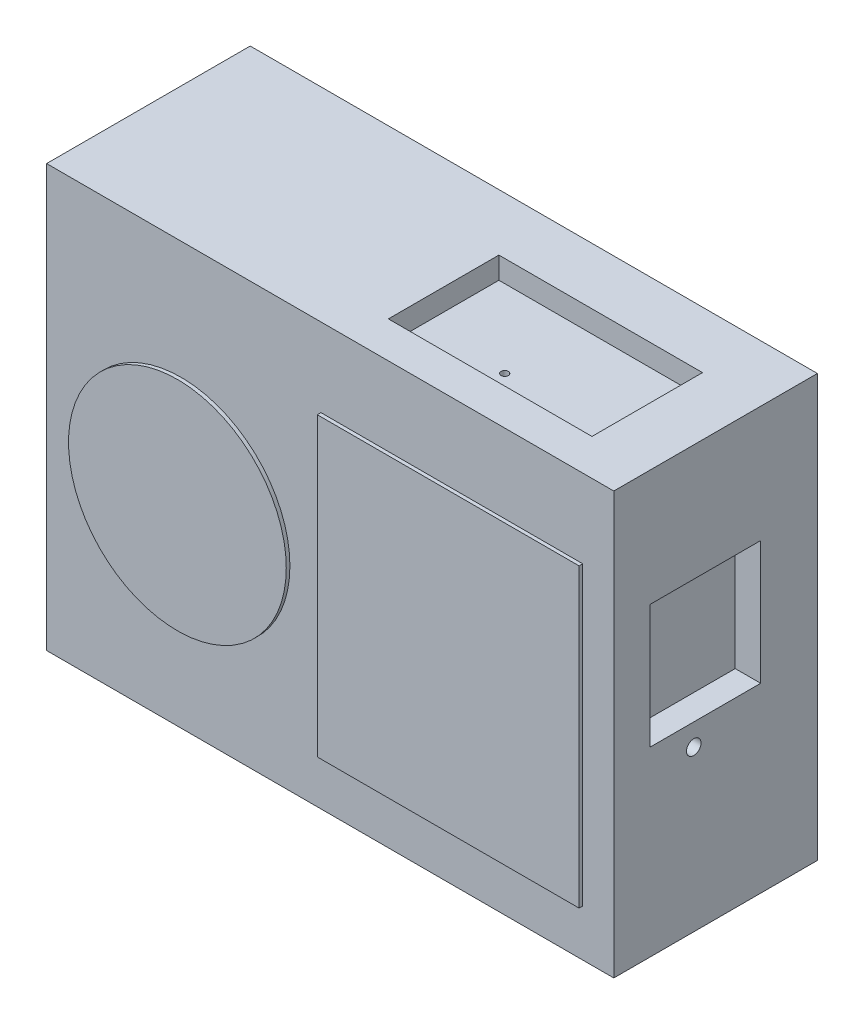
from build123d import *

# Parameters (mm, degrees)
SKETCH_1_W          = 78
SKETCH_1_H          = 58
EXTRUDE_1_DEPTH     = 28
SKETCH_2_W          = 28
SKETCH_2_H          = 15.2
CUT_EXTRUDE_1_DEPTH = 3
SKETCH_5_R          = 14.972823893
SKETCH_5_W          = 36.008932868
SKETCH_5_H          = 40.760932053
EXTRUDE_4_DEPTH     = 0.5
SKETCH_6_R          = 0.5
CUT_EXTRUDE_2_DEPTH = 5
SKETCH_7_R          = 1
SKETCH_7_W          = 15.2
SKETCH_7_H          = 17
CUT_EXTRUDE_3_DEPTH = 3.5


with BuildPart() as part:
    # 草图1 → 凸台-拉伸1 (new body)
    with BuildSketch(Plane.XY):
        with Locations((39, -29)):
            Rectangle(SKETCH_1_W, SKETCH_1_H)
    extrude(amount=EXTRUDE_1_DEPTH)

    # 草图2 → 切除-拉伸1 (cut)
    with BuildSketch(Plane(origin=(0, 0, 0), x_dir=(1, 0, 0), z_dir=(0, 1, 0))):
        with Locations((56, -15.4)):
            Rectangle(SKETCH_2_W, SKETCH_2_H)
    extrude(amount=-CUT_EXTRUDE_1_DEPTH, mode=Mode.SUBTRACT)

    # 草图5 → 凸台-拉伸4 (add)
    with BuildSketch(Plane.XY.offset(28)):
        with Locations((18.486091334, -31.18136891)):
            Circle(SKETCH_5_R)
        with Locations((55.726307101, -31.18136891)):
            Rectangle(SKETCH_5_W, SKETCH_5_H)
    extrude(amount=EXTRUDE_4_DEPTH)

    # 草图6 → 切除-拉伸2 (cut)
    with BuildSketch(Plane(origin=(0, -3, 0), x_dir=(1, 0, 0), z_dir=(0, 1, 0))):
        with Locations(Location((53.5, -18.5, 0), (0, 0, 270))):
            Circle(SKETCH_6_R)
    extrude(amount=-CUT_EXTRUDE_2_DEPTH, mode=Mode.SUBTRACT)

    # 草图7 → 切除-拉伸3 (cut)
    with BuildSketch(Plane(origin=(78, 0, 0), x_dir=(0, 0, -1), z_dir=(1, 0, 0))):
        with Locations(Location((-17, -36, 0), (0, 0, 90))):
            Circle(SKETCH_7_R)
        with Locations((-15.4, -24.5)):
            Rectangle(SKETCH_7_W, SKETCH_7_H)
    extrude(amount=-CUT_EXTRUDE_3_DEPTH, mode=Mode.SUBTRACT)


solid = part.part
